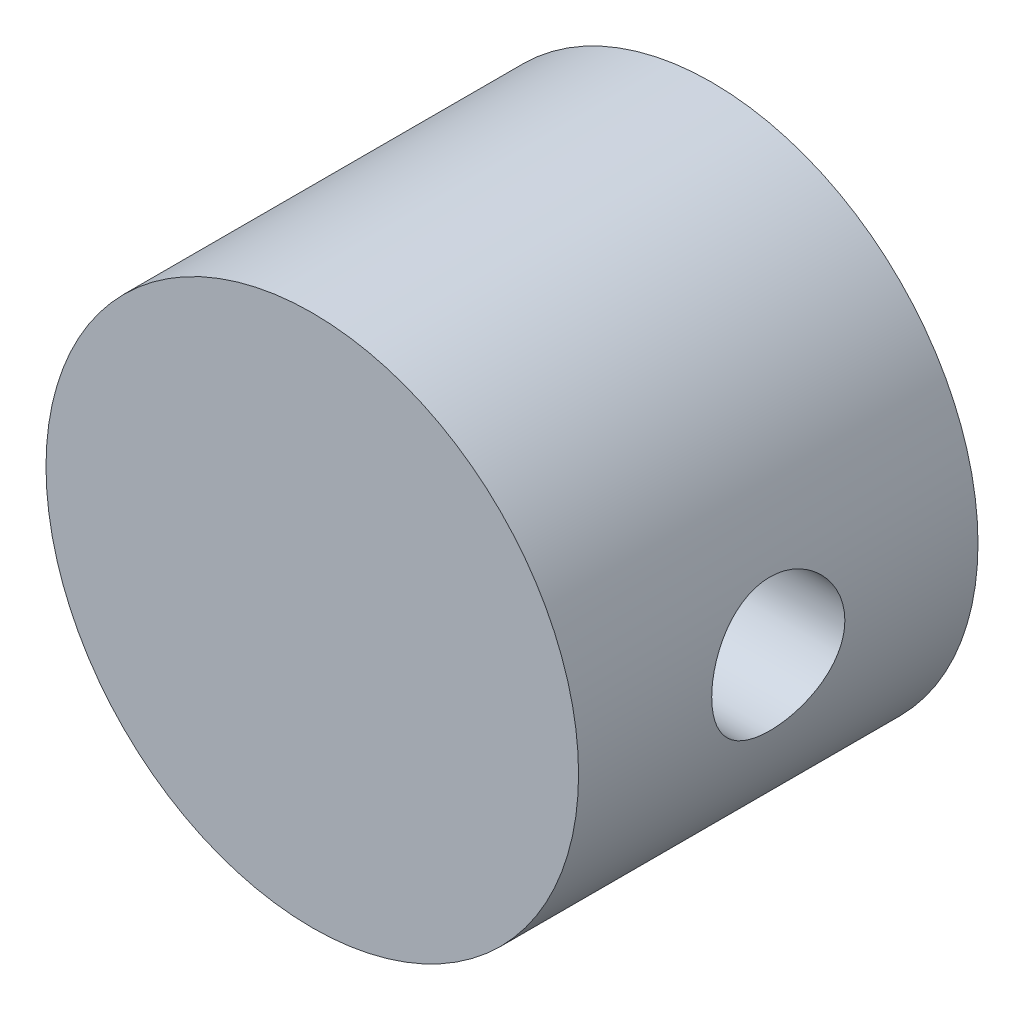
from build123d import *

# Parameters (mm, degrees)
SKETCH1_W           = 16
SKETCH1_H           = 16
BOSS_EXTRUDE1_DEPTH = 12
CUT_EXTRUDE1_DEPTH  = 13
SKETCH2_R           = 2
CUT_EXTRUDE2_DEPTH  = 10


with BuildPart() as part:
    # Sketch1 → Boss-Extrude1 (new body)
    with BuildSketch(Plane.XY):
        with Locations((-14.67401686, 4.154520967)):
            Rectangle(SKETCH1_W, SKETCH1_H)
    extrude(amount=BOSS_EXTRUDE1_DEPTH)

    # Sketch3 → Cut-Extrude1 (cut)
    with BuildSketch(Plane.XY.offset(12)):
        with BuildLine():
            Line((-6.67401686, 12.154520967), (-14.67401686, 12.154520967))
            ThreePointArc((-14.67401686, 12.154520967), (-9.017162611, 9.811375216), (-6.67401686, 4.154520967))
            Line((-6.67401686, 4.154520967), (-6.67401686, 12.154520967))
        make_face()
        with BuildLine():
            Line((-6.67401686, -3.845479033), (-6.67401686, 4.154520967))
            ThreePointArc((-6.67401686, 4.154520967), (-9.017162611, -1.502333283), (-14.67401686, -3.845479033))
            Line((-14.67401686, -3.845479033), (-6.67401686, -3.845479033))
        make_face()
        with BuildLine():
            Line((-14.67401686, 12.154520967), (-22.67401686, 12.154520967))
            Line((-22.67401686, 12.154520967), (-22.67401686, 4.154520967))
            ThreePointArc((-22.67401686, 4.154520967), (-20.33087111, 9.811375216), (-14.67401686, 12.154520967))
        make_face()
        with BuildLine():
            ThreePointArc((-14.67401686, -3.845479033), (-20.33087111, -1.502333283), (-22.67401686, 4.154520967))
            Line((-22.67401686, 4.154520967), (-22.67401686, -3.845479033))
            Line((-22.67401686, -3.845479033), (-14.67401686, -3.845479033))
        make_face()
    extrude(amount=-CUT_EXTRUDE1_DEPTH, mode=Mode.SUBTRACT)

    # Sketch2 → Cut-Extrude2 (cut)
    with BuildSketch(Plane(origin=(-6.67401686, 0, 0), x_dir=(0, 0, -1), z_dir=(1, 0, 0))):
        with Locations(Location((-6, 4.154520967, 0), (0, 0, 90))):
            Circle(SKETCH2_R)
    extrude(amount=-CUT_EXTRUDE2_DEPTH, mode=Mode.SUBTRACT)


solid = part.part
